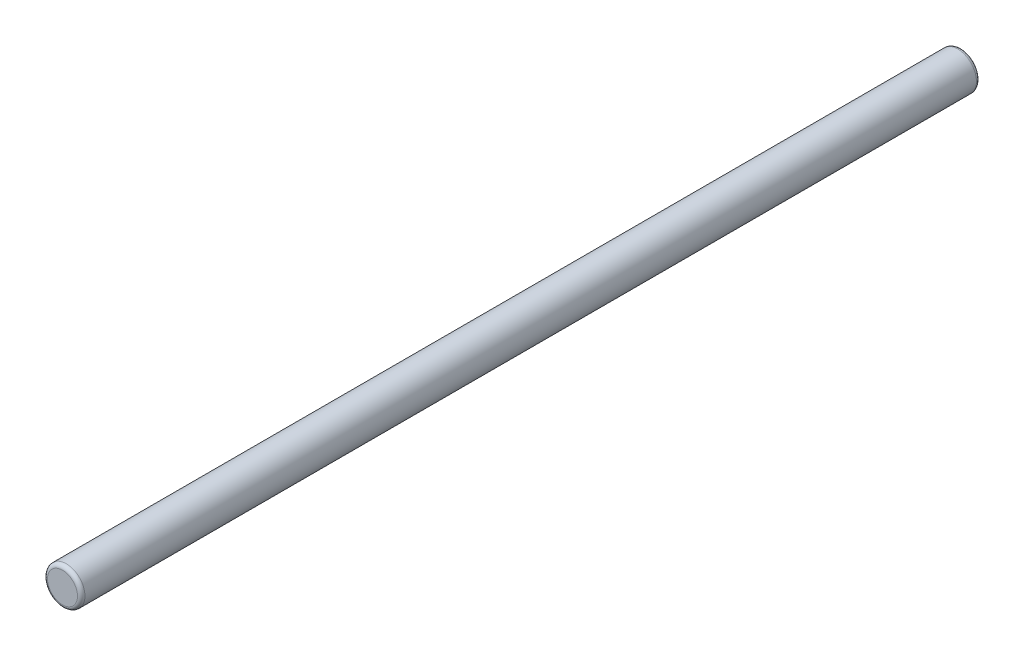
from build123d import *

# Parameters (mm, degrees)
SKETCH1_R           = 2.5
BOSS_EXTRUDE1_DEPTH = 120
FILLET1_R           = 0.5


with BuildPart() as part:
    # Sketch1 → Boss-Extrude1 (new body)
    with BuildSketch(Plane.XY):
        Circle(SKETCH1_R)
    extrude(amount=BOSS_EXTRUDE1_DEPTH)

    # Fillet1
    fillet1_edges = [part.edges().sort_by_distance(p)[0] for p in [
        (-2.5, 0, 0),
        (-2.5, 0, 120),
    ]]
    fillet(fillet1_edges, radius=FILLET1_R)


solid = part.part
